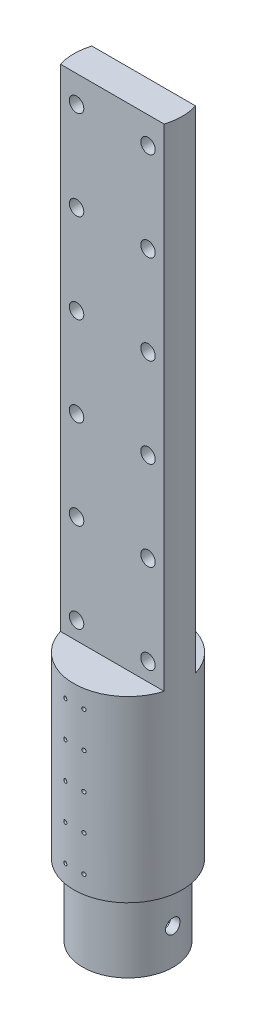
from build123d import *

# Parameters (mm, degrees)
SKETCH1_R               = 30.35
BOSS_EXTRUDE2_DEPTH     = 375
SKETCH1_3_R             = 25.35
SKETCH1_3_R_2           = 20.35
BOSS_EXTRUDE3_DEPTH     = 40
CUT_EXTRUDE3_START      = -275
CUT_EXTRUDE3_DEPTH      = 275
SKETCH8_R               = 1.05
CUT_EXTRUDE5_DEPTH      = 137
CUT_EXTRUDE6_DEPTH      = 137
CUT_EXTRUDE6_DEPTH_BACK = 137
SKETCH9_R               = 4.05
SKETCH10_R              = 4.05
CUT_EXTRUDE7_DEPTH      = 137


with BuildPart() as part:
    # Sketch1 → Boss-Extrude2 (new body)
    with BuildSketch(Plane(origin=(0, 0, 0), x_dir=(1, 0, 0), z_dir=(0, 1, 0))):
        Circle(SKETCH1_R)
    extrude(amount=BOSS_EXTRUDE2_DEPTH)

    # Sketch1<3> → Boss-Extrude3 (add)
    with BuildSketch(Plane(origin=(0, 0, 0), x_dir=(1, 0, 0), z_dir=(0, 1, 0))):
        Circle(SKETCH1_3_R)
        Circle(SKETCH1_3_R_2, mode=Mode.SUBTRACT)
    extrude(amount=-BOSS_EXTRUDE3_DEPTH)

    # Sketch6 → Cut-Extrude3 (cut)
    with BuildSketch(Plane(origin=(0, 375, 0), x_dir=(1, 0, 0), z_dir=(0, 1, 0)).offset(CUT_EXTRUDE3_START)):
        with BuildLine():
            Line((29.046213178, -8.8), (-29.046213178, -8.8))
            ThreePointArc((-29.046213178, -8.8), (-27.310672817, -13.238189087), (-24.901807163, -17.35))
            Line((-24.901807163, -17.35), (-42.831763914, -17.35))
            ThreePointArc((-42.831763914, -17.35), (0, -46.212363064), (42.831763914, -17.35))
            Line((42.831763914, -17.35), (24.901807163, -17.35))
            ThreePointArc((24.901807163, -17.35), (27.310672817, -13.238189087), (29.046213178, -8.8))
        make_face()
        with BuildLine():
            Line((-29.046213178, 8.8), (29.046213178, 8.8))
            ThreePointArc((29.046213178, 8.8), (27.310672817, 13.238189087), (24.901807163, 17.35))
            Line((24.901807163, 17.35), (42.831763914, 17.35))
            ThreePointArc((42.831763914, 17.35), (0, 46.212363064), (-42.831763914, 17.35))
            Line((-42.831763914, 17.35), (-24.901807163, 17.35))
            ThreePointArc((-24.901807163, 17.35), (-27.310672817, 13.238189087), (-29.046213178, 8.8))
        make_face()
    extrude(amount=CUT_EXTRUDE3_DEPTH, mode=Mode.SUBTRACT)

    # Sketch8 → Cut-Extrude5 (cut)
    with BuildSketch(Plane.XY.offset(30.35)):
        with Locations((5.215, 50)):
            Circle(SKETCH8_R)
        with Locations((-5.215, 50)):
            Circle(SKETCH8_R)
        with Locations((-5.215, 70)):
            Circle(SKETCH8_R)
        with Locations((5.215, 70)):
            Circle(SKETCH8_R)
        with Locations((-5.215, 90)):
            Circle(SKETCH8_R)
        with Locations((5.215, 90)):
            Circle(SKETCH8_R)
        with Locations((5.215, 30)):
            Circle(SKETCH8_R)
        with Locations((-5.215, 30)):
            Circle(SKETCH8_R)
        with Locations((5.215, 10)):
            Circle(SKETCH8_R)
        with Locations((-5.215, 10)):
            Circle(SKETCH8_R)
    extrude(amount=-CUT_EXTRUDE5_DEPTH, mode=Mode.SUBTRACT)

    # Sketch9 → Cut-Extrude6 (cut, two sides: drawn at the far end of the back side and taken through both)
    with BuildSketch(Plane(origin=(0, 0, 0), x_dir=(0, 0, -1), z_dir=(1, 0, 0)).offset(-CUT_EXTRUDE6_DEPTH_BACK)):
        with Locations((0, -20)):
            Circle(SKETCH9_R)
    extrude(amount=CUT_EXTRUDE6_DEPTH + CUT_EXTRUDE6_DEPTH_BACK, mode=Mode.SUBTRACT)

    # Sketch10 → Cut-Extrude7 (cut)
    with BuildSketch(Plane(origin=(0, 0, -8.8), x_dir=(-1, 0, 0), z_dir=(0, 0, -1))):
        with Locations((-20, 110)):
            Circle(SKETCH10_R)
        with Locations((20, 110)):
            Circle(SKETCH10_R)
        with Locations((-20, 160)):
            Circle(SKETCH10_R)
        with Locations((20, 160)):
            Circle(SKETCH10_R)
        with Locations((-20, 210)):
            Circle(SKETCH10_R)
        with Locations((20, 210)):
            Circle(SKETCH10_R)
        with Locations((-20, 260)):
            Circle(SKETCH10_R)
        with Locations((20, 260)):
            Circle(SKETCH10_R)
        with Locations((-20, 310)):
            Circle(SKETCH10_R)
        with Locations((20, 310)):
            Circle(SKETCH10_R)
        with Locations((-20, 360)):
            Circle(SKETCH10_R)
        with Locations((20, 360)):
            Circle(SKETCH10_R)
    extrude(amount=-CUT_EXTRUDE7_DEPTH, mode=Mode.SUBTRACT)


solid = part.part
